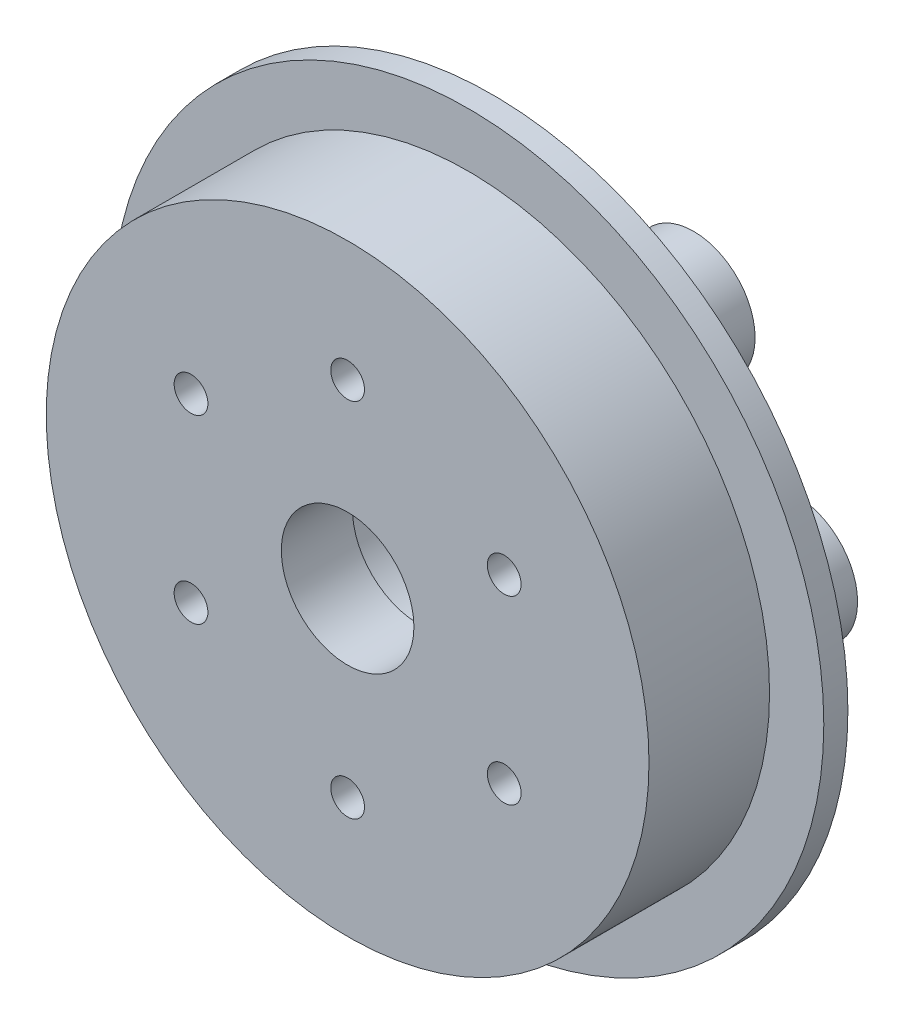
from build123d import *

# Parameters (mm, degrees)
SKETCH_2_R          = 29.5
EXTRUDE_1_DEPTH     = 2
SKETCH_3_R          = 25
EXTRUDE_2_DEPTH     = 10
SKETCH_4_R          = 5.1
EXTRUDE_3_DEPTH     = 8.2
SKETCH_7_R          = 1.4
CUT_EXTRUDE_3_DEPTH = 12
CUT_EXTRUDE_4_REACH = 45.411
SKETCH_9_R          = 6.5
EXTRUDE_START       = -5.9
SKETCH_10_R         = 6.5
SKETCH_10_R_2       = 5.5
EXTRUDE_4_DEPTH     = 5.9


with BuildPart() as part:
    # 草图2 → 凸台-拉伸1 (new body)
    with BuildSketch(Plane.XY):
        Circle(SKETCH_2_R)
    extrude(amount=EXTRUDE_1_DEPTH)

    # 草图3 → 凸台-拉伸2 (add)
    with BuildSketch(Plane.XY.offset(2)):
        Circle(SKETCH_3_R)
    extrude(amount=EXTRUDE_2_DEPTH)

    # 草图4 → 凸台-拉伸3 (add)
    with BuildSketch(Plane(origin=(0, 0, 0), x_dir=(-1, 0, 0), z_dir=(0, 0, -1))):
        with Locations(Location((17, 0, 0), (0, 0, 180))):
            Circle(SKETCH_4_R)
        with Locations(Location((8.5, -14.722431864, 0), (0, 0, 180))):
            Circle(SKETCH_4_R)
        with Locations(Location((-8.5, -14.722431864, 0), (0, 0, 180))):
            Circle(SKETCH_4_R)
        with Locations(Location((-17, 0, 0), (0, 0, 180))):
            Circle(SKETCH_4_R)
        with Locations(Location((-8.5, 14.722431864, 0), (0, 0, 180))):
            Circle(SKETCH_4_R)
        with Locations(Location((8.5, 14.722431864, 0), (0, 0, 180))):
            Circle(SKETCH_4_R)
    extrude(amount=EXTRUDE_3_DEPTH)

    # 草图7 → 切除-拉伸3 (cut)
    with BuildSketch(Plane.XY.offset(12)):
        with Locations((12.990381057, 7.5)):
            Circle(SKETCH_7_R)
        with Locations((12.990381057, -7.5)):
            Circle(SKETCH_7_R)
        with Locations((0, -15)):
            Circle(SKETCH_7_R)
        with Locations((-12.990381057, -7.5)):
            Circle(SKETCH_7_R)
        with Locations((-12.990381057, 7.5)):
            Circle(SKETCH_7_R)
        with Locations((0, 15)):
            Circle(SKETCH_7_R)
    extrude(amount=-CUT_EXTRUDE_3_DEPTH, mode=Mode.SUBTRACT)

    # 草图9 → 切除-拉伸4 (cut, up to next)
    with BuildSketch(Plane(origin=(0, 0, 0), x_dir=(-1, 0, 0), z_dir=(0, 0, -1)), mode=Mode.PRIVATE) as cut_extrude_4_sk1:
        Circle(SKETCH_9_R)
    cut_extrude_4_tool1 = extrude(cut_extrude_4_sk1.sketch, amount=-CUT_EXTRUDE_4_REACH, mode=Mode.PRIVATE) & part.part
    add(cut_extrude_4_tool1.solids().sort_by_distance((0, 0, 0))[0], mode=Mode.SUBTRACT)

    # 草图10 → 凸台-拉伸4 (add)
    with BuildSketch(Plane.XY.offset(12).offset(EXTRUDE_START)):
        with Locations(Location((0, 0, 0), (0, 0, 180))):
            Circle(SKETCH_10_R)
        Circle(SKETCH_10_R_2, mode=Mode.SUBTRACT)
    extrude(amount=EXTRUDE_4_DEPTH)


solid = part.part
